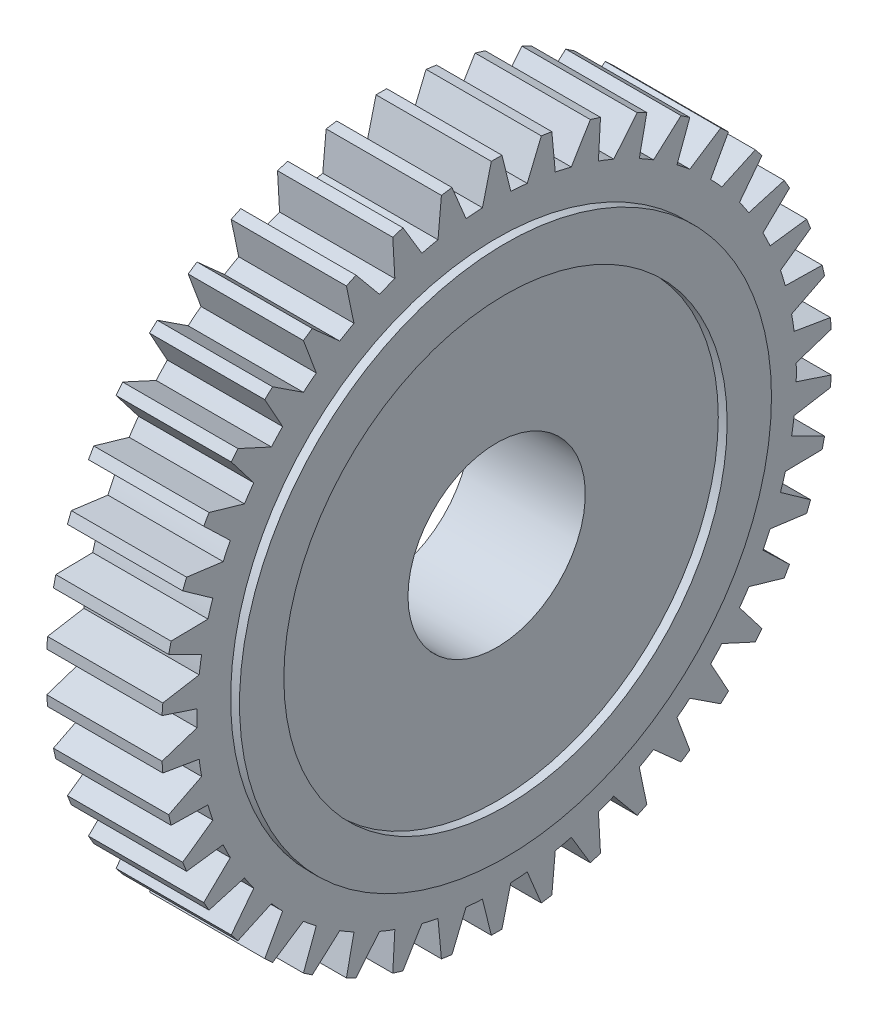
from build123d import *

# Parameters (mm, degrees)
SKETCH1_R           = 33.8
SKETCH1_R_2         = 10
BOSS_EXTRUDE1_DEPTH = 6.5
SKETCH1_3_R         = 30
SKETCH1_3_R_2       = 25
BOSS_EXTRUDE2_DEPTH = 7.5
BOSS_EXTRUDE3_DEPTH = 6.5
CIRPATTERN1_COUNT   = 42


with BuildPart() as part:
    # Sketch1 → Boss-Extrude1 (new, symmetric)
    with BuildSketch(Plane.YZ):
        Circle(SKETCH1_R)
        Circle(SKETCH1_R_2, mode=Mode.SUBTRACT)
    extrude(amount=BOSS_EXTRUDE1_DEPTH, both=True)

    # Sketch1<3> → Boss-Extrude2 (add, symmetric)
    with BuildSketch(Plane.YZ):
        Circle(SKETCH1_3_R)
        Circle(SKETCH1_3_R_2, mode=Mode.SUBTRACT)
    extrude(amount=BOSS_EXTRUDE2_DEPTH, both=True)

    # Sketch1<4> → Boss-Extrude3 (add, symmetric)
    with BuildSketch(Plane.YZ):
        with BuildLine():
            Line((-33.7621436, 1.599268434), (-37.8, 0.6))
            Line((-37.8, 0.6), (-37.8, -0.6))
            Line((-37.8, -0.6), (-33.7621436, -1.599268434))
            ThreePointArc((-33.7621436, -1.599268434), (-33.8, 0), (-33.7621436, 1.599268434))
        make_face()
    boss_extrude3 = extrude(amount=BOSS_EXTRUDE3_DEPTH, both=True)

    # CirPattern1: Boss-Extrude3 ×42 about axis
    cirpattern1_axis = Axis((6.5, 0, 0), (1, 0, 0))
    for i in range(1, CIRPATTERN1_COUNT):
        add(boss_extrude3.rotate(cirpattern1_axis, i * 360 / CIRPATTERN1_COUNT))


solid = part.part
